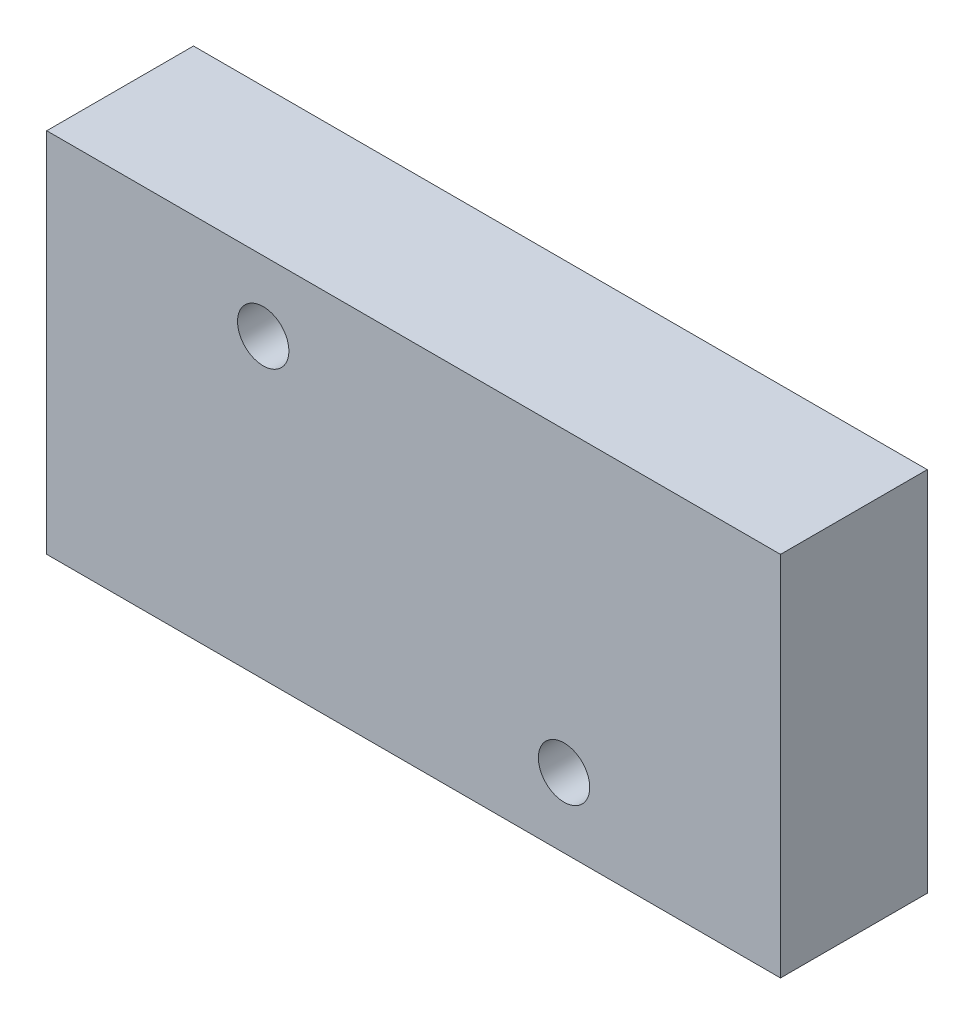
from build123d import *

# Parameters (mm, degrees)
SKETCH1_W           = 50
SKETCH1_H           = 25
BOSS_EXTRUDE1_DEPTH = 10
SKETCH2_R           = 1.75
CUT_EXTRUDE1_DEPTH  = 10
SKETCH3_R           = 1.75
CUT_EXTRUDE2_DEPTH  = 10


with BuildPart() as part:
    # Sketch1 → Boss-Extrude1 (new body)
    with BuildSketch(Plane.XY):
        with Locations((-6.627906977, 5.813953488)):
            Rectangle(SKETCH1_W, SKETCH1_H)
    extrude(amount=BOSS_EXTRUDE1_DEPTH)

    # Sketch2 → Cut-Extrude1 (cut)
    with BuildSketch(Plane.XY.offset(10)):
        with Locations((-16.877906977, 13.563953488)):
            Circle(SKETCH2_R)
    extrude(amount=-CUT_EXTRUDE1_DEPTH, mode=Mode.SUBTRACT)

    # Sketch3 → Cut-Extrude2 (cut)
    with BuildSketch(Plane.XY.offset(10)):
        with Locations((3.622093023, -1.936046512)):
            Circle(SKETCH3_R)
    extrude(amount=-CUT_EXTRUDE2_DEPTH, mode=Mode.SUBTRACT)


solid = part.part
